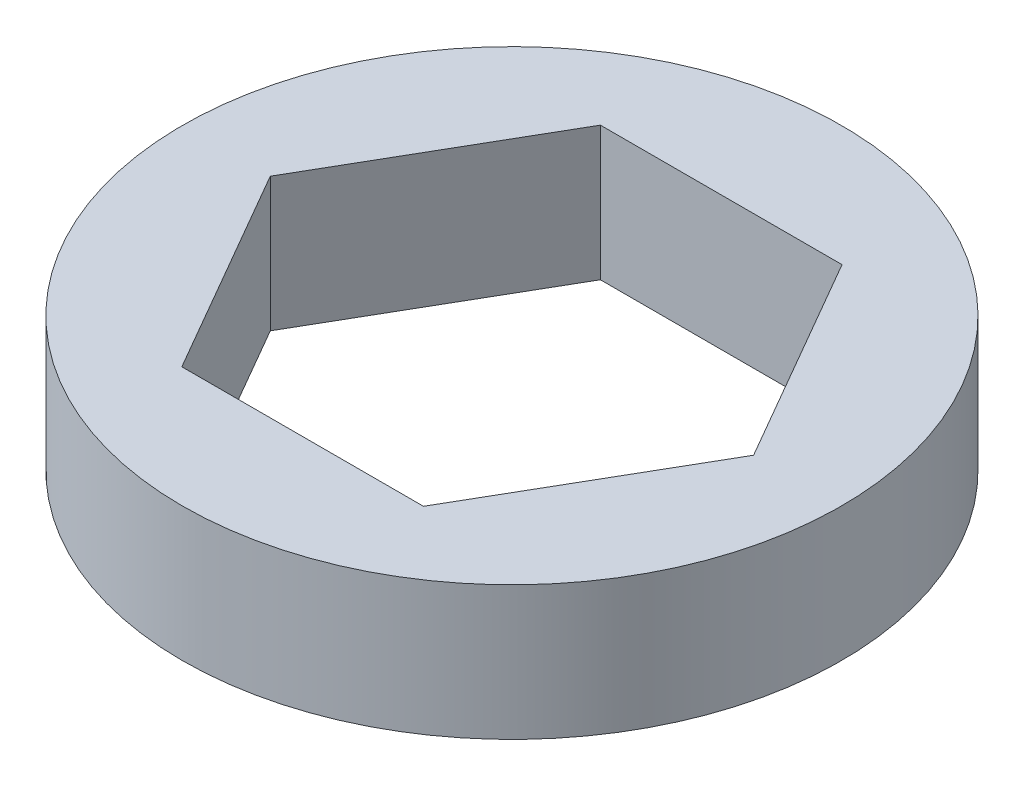
from build123d import *

# Parameters (mm, degrees)
SKETCH1_R           = 10
BOSS_EXTRUDE1_DEPTH = 4.064


with BuildPart() as part:
    # Sketch1 → Boss-Extrude1 (new body)
    with BuildSketch(Plane(origin=(0, 0, 0), x_dir=(1, 0, 0), z_dir=(0, 1, 0))):
        with Locations(Location((0, 0, 0), (0, 0, 270))):
            Circle(SKETCH1_R)
        Polygon((-7.332348419, 0), (-3.666174209, -6.35), (3.666174209, -6.35), (7.332348419, 0), (3.666174209, 6.35), (-3.666174209, 6.35), align=None, mode=Mode.SUBTRACT)
    extrude(amount=BOSS_EXTRUDE1_DEPTH)


solid = part.part
